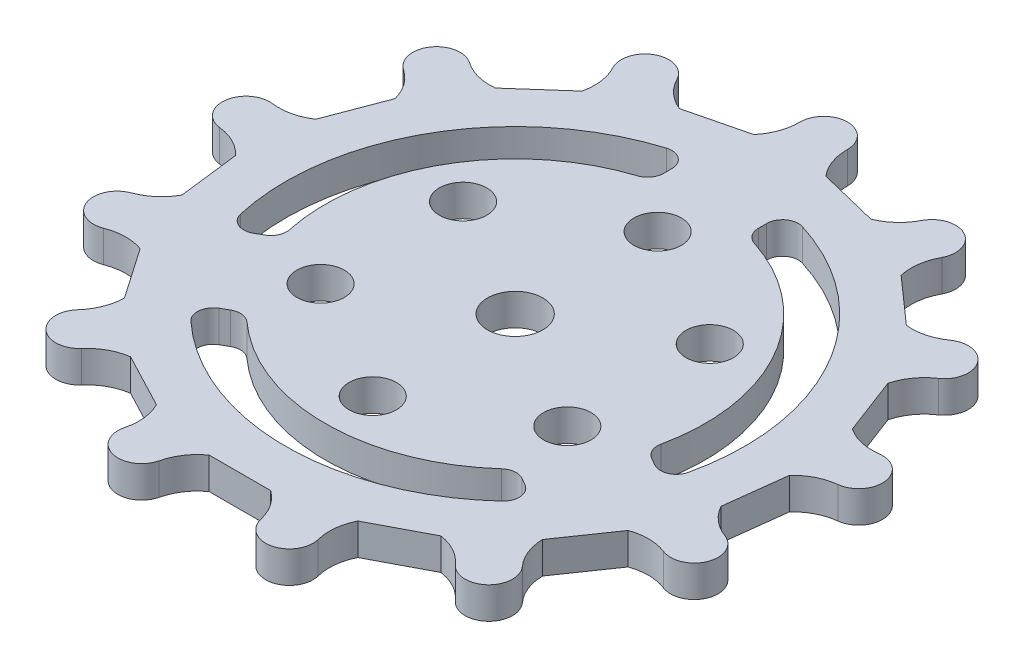
from build123d import *

# Parameters (mm, degrees)
SKETCH1_R           = 1.5
SKETCH1_R_2         = 1.75
BOSS_EXTRUDE3_DEPTH = 2
CUT_EXTRUDE1_DEPTH  = 2
FILLET1_R           = 1
SCALE1_SCALE        = 2


with BuildPart() as part:
    # Sketch1 → Boss-Extrude3 (new body)
    with BuildSketch(Plane(origin=(0, 0, 0), x_dir=(1, 0, 0), z_dir=(0, 1, 0))):
        with BuildLine():
            Line((6.048353149, 16.421553647), (2.27592576, 17.351373488))
            ThreePointArc((2.27592576, 17.351373488), (1.69730064, 18.342788524), (1.499767326, 19.473580897))
            ThreePointArc((1.499767326, 19.473580897), (1.49994183, 19.486789936), (1.5, 19.5))
            ThreePointArc((1.5, 19.5), (0, 21), (-1.5, 19.5))
            ThreePointArc((-1.5, 19.5), (-1.49994183, 19.486789936), (-1.499767326, 19.473580897))
            ThreePointArc((-1.499767326, 19.473580897), (-1.69730064, 18.342788524), (-2.27592576, 17.351373488))
            Line((-2.27592576, 17.351373488), (-6.048353149, 16.421553647))
            ThreePointArc((-6.048353149, 16.421553647), (-7.021433788, 17.030507563), (-7.72184627, 17.939976175))
            ThreePointArc((-7.72184627, 17.939976175), (-7.7278303, 17.951753295), (-7.733917816, 17.963477258))
            ThreePointArc((-7.733917816, 17.963477258), (-9.759186613, 18.594576539), (-10.390285893, 16.569307742))
            ThreePointArc((-10.390285893, 16.569307742), (-10.384020417, 16.557678026), (-10.377802301, 16.546022918))
            ThreePointArc((-10.377802301, 16.546022918), (-10.027203946, 15.452957688), (-10.078817505, 14.30620277))
            Line((-10.078817505, 14.30620277), (-12.987027242, 11.729753767))
            ThreePointArc((-12.987027242, 11.729753767), (-14.131642352, 11.81674256), (-15.174477944, 12.296539112))
            ThreePointArc((-15.174477944, 12.296539112), (-15.18524964, 12.304186316), (-15.196088265, 12.31173836))
            ThreePointArc((-15.196088265, 12.31173836), (-17.282661184, 11.929359681), (-16.900282505, 9.842786762))
            ThreePointArc((-16.900282505, 9.842786762), (-16.889330102, 9.835400872), (-16.878407836, 9.827970489))
            ThreePointArc((-16.878407836, 9.827970489), (-16.059995669, 9.023040475), (-15.572773623, 7.983653406))
            Line((-15.572773623, 7.983653406), (-16.950529904, 4.350808657))
            ThreePointArc((-16.950529904, 4.350808657), (-18.004461959, 3.895904243), (-19.150819593, 3.836113127))
            ThreePointArc((-19.150819593, 3.836113127), (-19.163911289, 3.837878533), (-19.177018025, 3.839528576))
            ThreePointArc((-19.177018025, 3.839528576), (-20.846886356, 2.531270285), (-19.538628065, 0.861401954))
            ThreePointArc((-19.538628065, 0.861401954), (-19.5254978, 0.859951908), (-19.512373542, 0.858448461))
            ThreePointArc((-19.512373542, 0.858448461), (-18.413635928, 0.526053428), (-17.499194975, -0.167854741))
            Line((-17.499194975, -0.167854741), (-17.030870442, -4.024854283))
            ThreePointArc((-17.030870442, -4.024854283), (-17.752676308, -4.917438785), (-18.739939265, -5.503120145))
            ThreePointArc((-18.739939265, -5.503120145), (-18.752351812, -5.50764097), (-18.764724063, -5.512270933))
            ThreePointArc((-18.764724063, -5.512270933), (-19.635341096, -7.446702628), (-17.700909402, -8.317319661))
            ThreePointArc((-17.700909402, -8.317319661), (-17.688609259, -8.312501675), (-17.676289619, -8.307733764))
            ThreePointArc((-17.676289619, -8.307733764), (-16.548934104, -8.09144612), (-15.416761648, -8.280909389))
            Line((-15.416761648, -8.280909389), (-13.209643805, -11.478471612))
            ThreePointArc((-13.209643805, -11.478471612), (-13.433966457, -12.604255849), (-14.035964693, -13.581654911))
            ThreePointArc((-14.035964693, -13.581654911), (-14.044854525, -13.591426301), (-14.053657958, -13.601275602))
            ThreePointArc((-14.053657958, -13.601275602), (-13.925575823, -15.718725712), (-11.808125713, -15.590643577))
            ThreePointArc((-11.808125713, -15.590643577), (-11.799473508, -15.5806613), (-11.790780767, -15.570714303))
            ThreePointArc((-11.790780767, -15.570714303), (-10.893070914, -14.855292874), (-9.802534018, -14.496907492))
            Line((-9.802534018, -14.496907492), (-6.362246966, -16.302509425))
            ThreePointArc((-6.362246966, -16.302509425), (-6.037696789, -17.403589796), (-6.116519761, -18.548796214))
            ThreePointArc((-6.116519761, -18.548796214), (-6.119850325, -18.561579661), (-6.12306818, -18.574391943))
            ThreePointArc((-6.12306818, -18.574391943), (-5.02562895, -20.389778166), (-3.210242727, -19.292338936))
            ThreePointArc((-3.210242727, -19.292338936), (-3.207220575, -19.279479189), (-3.204146136, -19.266631842))
            ThreePointArc((-3.204146136, -19.266631842), (-2.741736452, -18.215971056), (-1.942663979, -17.391838795))
            Line((-1.942663979, -17.391838795), (1.942663979, -17.391838795))
            ThreePointArc((1.942663979, -17.391838795), (2.741736452, -18.215971056), (3.204146136, -19.266631842))
            ThreePointArc((3.204146136, -19.266631842), (3.207137832, -19.279498812), (3.210242727, -19.292338936))
            ThreePointArc((3.210242727, -19.292338936), (5.02562895, -20.389778166), (6.12306818, -18.574391943))
            ThreePointArc((6.12306818, -18.574391943), (6.11976794, -18.561600739), (6.116519761, -18.548796214))
            ThreePointArc((6.116519761, -18.548796214), (6.037696789, -17.403589796), (6.362246966, -16.302509425))
            Line((6.362246966, -16.302509425), (9.802534018, -14.496907492))
            ThreePointArc((9.802534018, -14.496907492), (10.893070914, -14.855292874), (11.790780767, -15.570714303))
            ThreePointArc((11.790780767, -15.570714303), (11.799409362, -15.580717128), (11.808125713, -15.590643577))
            ThreePointArc((11.808125713, -15.590643577), (13.925575823, -15.718725712), (14.053657958, -13.601275602))
            ThreePointArc((14.053657958, -13.601275602), (14.044791371, -13.591483251), (14.035964693, -13.581654911))
            ThreePointArc((14.035964693, -13.581654911), (13.433966458, -12.604255849), (13.209643805, -11.478471612))
            Line((13.209643805, -11.478471612), (15.416761648, -8.280909389))
            ThreePointArc((15.416761648, -8.280909389), (16.548934104, -8.09144612), (17.676289619, -8.307733764))
            ThreePointArc((17.676289619, -8.307733764), (17.688578405, -8.312580919), (17.700909402, -8.317319661))
            ThreePointArc((17.700909402, -8.317319661), (19.635341096, -7.446702628), (18.764724063, -5.512270933))
            ThreePointArc((18.764724063, -5.512270933), (18.752322358, -5.507720745), (18.739939265, -5.503120145))
            ThreePointArc((18.739939265, -5.503120145), (17.752676308, -4.917438785), (17.030870442, -4.024854283))
            Line((17.030870442, -4.024854283), (17.499194975, -0.167854741))
            ThreePointArc((17.499194975, -0.167854741), (18.413635928, 0.526053428), (19.512373542, 0.858448461))
            ThreePointArc((19.512373542, 0.858448461), (19.525507306, 0.859867402), (19.538628065, 0.861401954))
            ThreePointArc((19.538628065, 0.861401954), (20.846886356, 2.531270285), (19.177018025, 3.839528576))
            ThreePointArc((19.177018025, 3.839528576), (19.163922282, 3.837794208), (19.150819593, 3.836113127))
            ThreePointArc((19.150819593, 3.836113127), (18.004461959, 3.895904243), (16.950529904, 4.350808657))
            Line((16.950529904, 4.350808657), (15.572773623, 7.983653406))
            ThreePointArc((15.572773623, 7.983653406), (16.059995669, 9.023040475), (16.878407836, 9.827970489))
            ThreePointArc((16.878407836, 9.827970489), (16.889377792, 9.835330464), (16.900282505, 9.842786762))
            ThreePointArc((16.900282505, 9.842786762), (17.282661184, 11.929359681), (15.196088265, 12.31173836))
            ThreePointArc((15.196088265, 12.31173836), (15.185298562, 12.304116759), (15.174477944, 12.296539112))
            ThreePointArc((15.174477944, 12.296539112), (14.131642352, 11.81674256), (12.987027242, 11.729753767))
            Line((12.987027242, 11.729753767), (10.078817505, 14.30620277))
            ThreePointArc((10.078817505, 14.30620277), (10.027203946, 15.452957688), (10.377802301, 16.546022918))
            ThreePointArc((10.377802301, 16.546022918), (10.384095364, 16.557637845), (10.390285893, 16.569307742))
            ThreePointArc((10.390285893, 16.569307742), (9.759186613, 18.594576539), (7.733917816, 17.963477258))
            ThreePointArc((7.733917816, 17.963477258), (7.727905944, 17.95171444), (7.72184627, 17.939976175))
            ThreePointArc((7.72184627, 17.939976175), (7.021433788, 17.030507563), (6.048353149, 16.421553647))
        make_face()
        with Locations(Location((0, -9, 0), (0, 0, 270))):
            Circle(SKETCH1_R, mode=Mode.SUBTRACT)
        with Locations(Location((-7.794228634, -4.5, 0), (0, 0, 270))):
            Circle(SKETCH1_R, mode=Mode.SUBTRACT)
        with Locations(Location((0, 0, 0), (0, 0, 270))):
            Circle(SKETCH1_R_2, mode=Mode.SUBTRACT)
        with Locations(Location((7.794228634, -4.5, 0), (0, 0, 270))):
            Circle(SKETCH1_R, mode=Mode.SUBTRACT)
        with Locations(Location((-7.794228634, 4.5, 0), (0, 0, 270))):
            Circle(SKETCH1_R, mode=Mode.SUBTRACT)
        with Locations(Location((0, 9, 0), (0, 0, 270))):
            Circle(SKETCH1_R, mode=Mode.SUBTRACT)
        with Locations(Location((7.794228634, 4.5, 0), (0, 0, 270))):
            Circle(SKETCH1_R, mode=Mode.SUBTRACT)
    extrude(amount=BOSS_EXTRUDE3_DEPTH)

    # Sketch3 → Cut-Extrude1 (cut)
    with BuildSketch(Plane(origin=(0, 2, 0), x_dir=(1, 0, 0), z_dir=(0, 1, 0))):
        with BuildLine():
            Line((-3, 14.186260959), (-3, 11.618950039))
            ThreePointArc((-3, 11.618950039), (-10.392304845, 6), (-11.562305899, -3.211398808))
            Line((-11.562305899, -3.211398808), (-13.785662375, -4.495054268))
            ThreePointArc((-13.785662375, -4.495054268), (-12.557368355, 7.25), (-3, 14.186260959))
        make_face()
        with BuildLine():
            Line((3, 14.186260959), (3, 11.618950039))
            ThreePointArc((3, 11.618950039), (10.392304845, 6), (11.562305899, -3.211398808))
            Line((11.562305899, -3.211398808), (13.785662375, -4.495054268))
            ThreePointArc((13.785662375, -4.495054268), (12.557368355, 7.25), (3, 14.186260959))
        make_face()
        with BuildLine():
            Line((10.785662375, -9.691206691), (8.562305899, -8.407551231))
            ThreePointArc((8.562305899, -8.407551231), (0, -12), (-8.562305899, -8.407551231))
            Line((-8.562305899, -8.407551231), (-10.785662375, -9.691206691))
            ThreePointArc((-10.785662375, -9.691206691), (0, -14.5), (10.785662375, -9.691206691))
        make_face()
    extrude(amount=-CUT_EXTRUDE1_DEPTH, mode=Mode.SUBTRACT)

    # Fillet1
    fillet1_edges = [part.edges().sort_by_distance(p)[0] for p in [
        (-8.562305899, 1, 8.407551231),
        (8.562305899, 1, 8.407551231),
        (10.785662375, 1, 9.691206691),
        (-10.785662375, 1, 9.691206691),
        (11.562305899, 1, 3.211398808),
        (3, 1, -11.618950039),
        (3, 1, -14.186260959),
        (13.785662375, 1, 4.495054268),
        (-3, 1, -11.618950039),
        (-11.562305899, 1, 3.211398808),
        (-13.785662375, 1, 4.495054268),
        (-3, 1, -14.186260959),
    ]]
    fillet(fillet1_edges, radius=FILLET1_R)


with BuildPart() as part_1:
    # Scale1: scaled about (0, 0, 0)
    add(part.part.scale(SCALE1_SCALE))


solid = part_1.part
